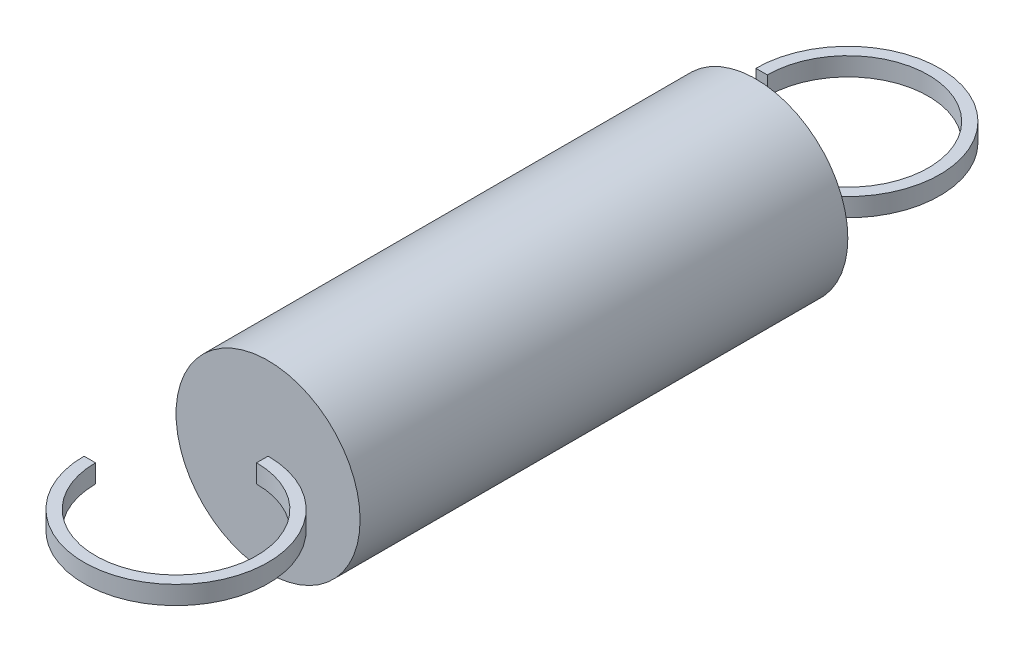
from build123d import *

# Parameters (mm, degrees)
SKETCH_1_R             = 10
EXTRUDE_1_DEPTH        = 53
EXTRUDE_2_DEPTH        = 1
EXTRUDE_2_DEPTH_BACK   = 1
EXTRUDE_2_2_DEPTH      = 1
EXTRUDE_2_2_DEPTH_BACK = 1


with BuildPart() as part:
    # 草图1 → 凸台-拉伸1 (new body)
    with BuildSketch(Plane.XY):
        Circle(SKETCH_1_R)
    extrude(amount=EXTRUDE_1_DEPTH)


with BuildPart() as body_2:
    # 草图5 → 凸台-拉伸2 (new, two sides: drawn at the far end of the back side and taken through both)
    with BuildSketch(Plane(origin=(0, 0, 0), x_dir=(1, 0, 0), z_dir=(0, 1, 0)).offset(-EXTRUDE_2_DEPTH_BACK)):
        with BuildLine():
            Line((-10, -63), (-8.75, -63))
            ThreePointArc((-8.75, -63), (6.187184335, -69.187184335), (0, -54.25))
            Line((0, -54.25), (0, -53))
            ThreePointArc((0, -53), (7.071067812, -70.071067812), (-10, -63))
        make_face()
    extrude(amount=EXTRUDE_2_DEPTH + EXTRUDE_2_DEPTH_BACK)


with BuildPart() as body_3:
    # 草图5 → Extrude 2 2 (new, two sides: drawn at the far end of the back side and taken through both)
    with BuildSketch(Plane(origin=(0, 0, 0), x_dir=(1, 0, 0), z_dir=(0, 1, 0)).offset(-EXTRUDE_2_2_DEPTH_BACK)):
        with BuildLine():
            Line((0, 1.25), (0, 0))
            ThreePointArc((0, 0), (7.071067812, 17.071067812), (-10, 10))
            Line((-10, 10), (-8.75, 10))
            ThreePointArc((-8.75, 10), (6.187184335, 16.187184335), (0, 1.25))
        make_face()
    extrude(amount=EXTRUDE_2_2_DEPTH + EXTRUDE_2_2_DEPTH_BACK)


solid = Compound([part.part, body_2.part, body_3.part])
